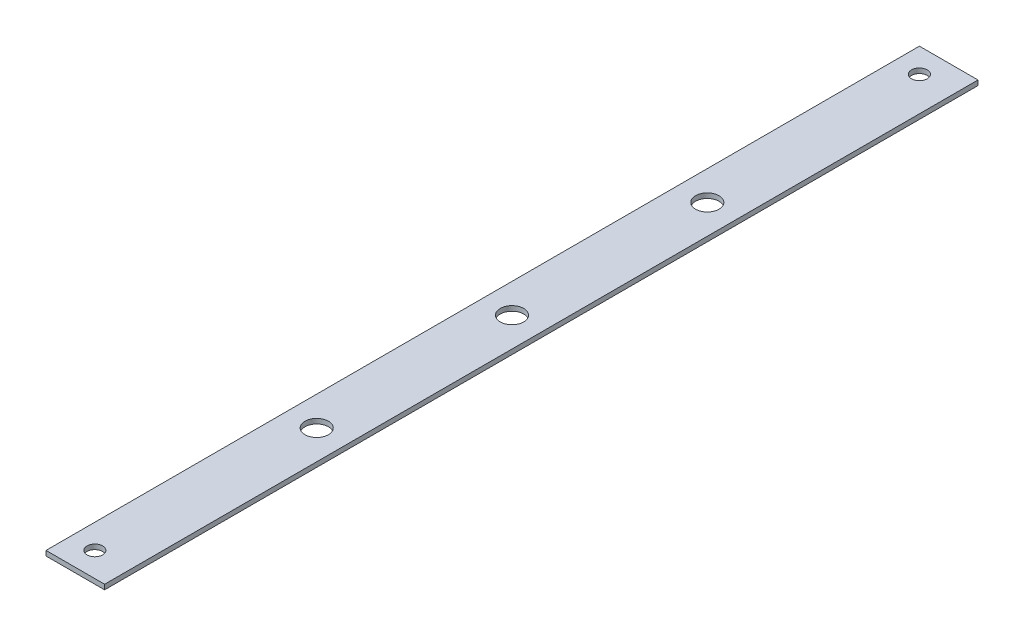
from build123d import *

# Parameters (mm, degrees)
BOSS_EXTRUDE1_DEPTH = 223.6
SKETCH2_R           = 4
SKETCH2_R_2         = 6
CUT_EXTRUDE1_DEPTH  = 226.617397379


with BuildPart() as part:
    # Sketch1 → Boss-Extrude1 (new, symmetric)
    with BuildSketch(Plane.XY):
        Polygon((2.5, 2.5), (0, 2.5), (0, 0), (30, 0), (30, 2.5), align=None)
    extrude(amount=BOSS_EXTRUDE1_DEPTH, both=True)

    # Sketch2 → Cut-Extrude1 (cut, through all)
    with BuildSketch(Plane(origin=(0, 2.5, 0), x_dir=(1, 0, 0), z_dir=(0, 1, 0))):
        with Locations(Location((12.5, 211.1, 0), (0, 0, 180))):
            Circle(SKETCH2_R)
        with Locations((12.5, -211.1)):
            Circle(SKETCH2_R)
        with Locations(Location((15, -100, 0), (0, 0, 180))):
            Circle(SKETCH2_R_2)
        with Locations((15, 100)):
            Circle(SKETCH2_R_2)
        with Locations(Location((15, 0, 0), (0, 0, 180))):
            Circle(SKETCH2_R_2)
    extrude(amount=-CUT_EXTRUDE1_DEPTH, mode=Mode.SUBTRACT)


solid = part.part
